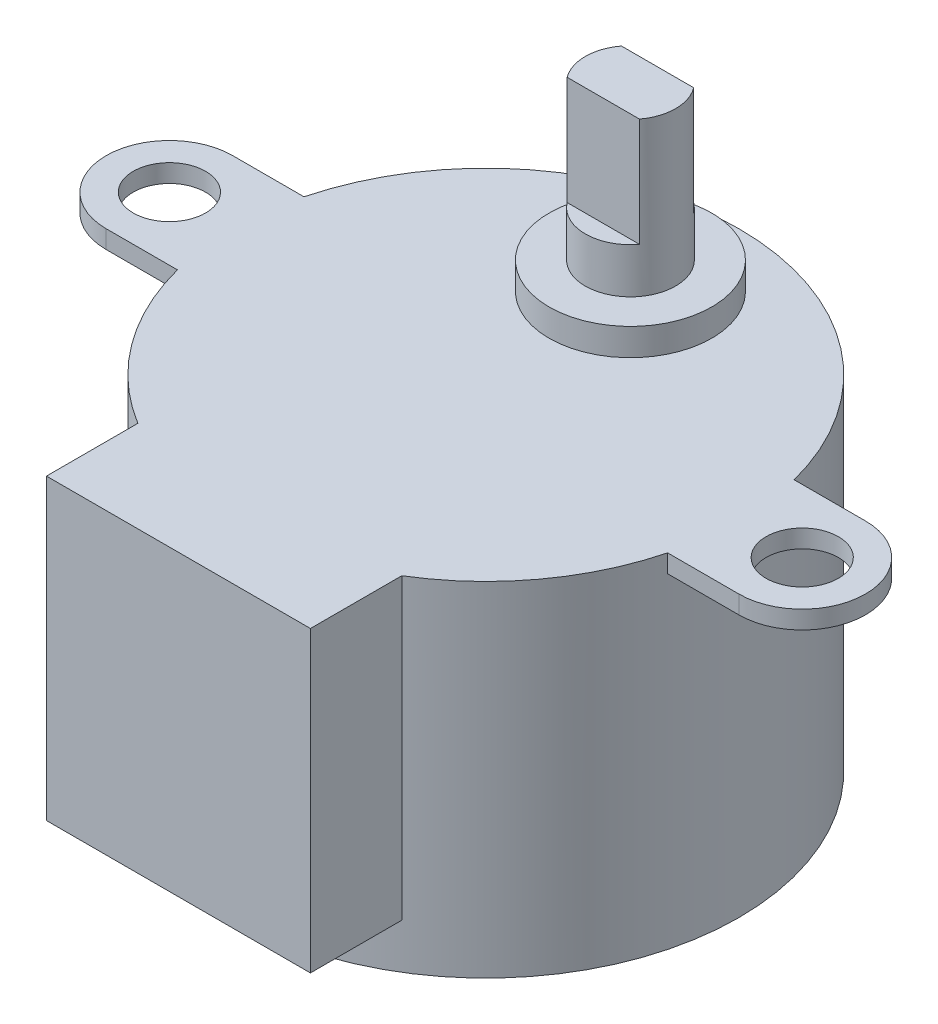
from build123d import *

# Parameters (mm, degrees)
SKETCH_1_R          = 14
EXTRUDE_1_DEPTH     = 19
SKETCH_2_R          = 4.5
EXTRUDE_2_DEPTH     = 1.5
SKETCH_3_R          = 2.5
EXTRUDE_3_DEPTH     = 8.5
CUT_EXTRUDE_START   = -6
CUT_EXTRUDE_1_DEPTH = 6
EXTRUDE_START       = -1
SKETCH_5_R          = 2
EXTRUDE_4_DEPTH     = 1
EXTRUDE_START_2     = -16.5
EXTRUDE_5_DEPTH     = 16.5


with BuildPart() as part:
    # Эскиз1 → Бобышка-Вытянуть1 (new body)
    with BuildSketch(Plane(origin=(0, 0, 0), x_dir=(1, 0, 0), z_dir=(0, 1, 0))):
        with Locations(Location((0, 0, 0), (0, 0, 270))):
            Circle(SKETCH_1_R)
    extrude(amount=EXTRUDE_1_DEPTH)

    # Эскиз2 → Бобышка-Вытянуть2 (add)
    with BuildSketch(Plane(origin=(0, 19, 0), x_dir=(1, 0, 0), z_dir=(0, 1, 0))):
        with Locations(Location((0, 8, 0), (0, 0, 270))):
            Circle(SKETCH_2_R)
    extrude(amount=EXTRUDE_2_DEPTH)

    # Эскиз3 → Бобышка-Вытянуть3 (add)
    with BuildSketch(Plane(origin=(0, 20.5, 0), x_dir=(1, 0, 0), z_dir=(0, 1, 0))):
        with Locations(Location((0, 8, 0), (0, 0, 270))):
            Circle(SKETCH_3_R)
    extrude(amount=EXTRUDE_3_DEPTH)

    # Эскиз4 → Вырез-Вытянуть1 (cut)
    with BuildSketch(Plane(origin=(0, 29, 0), x_dir=(1, 0, 0), z_dir=(0, 1, 0)).offset(CUT_EXTRUDE_START)):
        with BuildLine():
            Line((-2, 9.5), (2, 9.5))
            ThreePointArc((2, 9.5), (0, 10.5), (-2, 9.5))
        make_face()
        with BuildLine():
            Line((-2, 6.5), (2, 6.5))
            ThreePointArc((2, 6.5), (0, 5.5), (-2, 6.5))
        make_face()
    extrude(amount=CUT_EXTRUDE_1_DEPTH, mode=Mode.SUBTRACT)

    # Эскиз5 → Бобышка-Вытянуть4 (add)
    # profile 1 of 2: a face of its own
    with BuildSketch(Plane(origin=(0, 19, 0), x_dir=(1, 0, 0), z_dir=(0, 1, 0)).offset(EXTRUDE_START)):
        with BuildLine():
            Line((-17.5, 3.5), (-13.555441712, 3.5))
            ThreePointArc((-13.555441712, 3.5), (-14, 0), (-13.555441712, -3.5))
            Line((-13.555441712, -3.5), (-17.5, -3.5))
            ThreePointArc((-17.5, -3.5), (-21, 0), (-17.5, 3.5))
        make_face()
        with Locations(Location((-17.5, 0, 0), (0, 0, 270))):
            Circle(SKETCH_5_R, mode=Mode.SUBTRACT)
    # profile 2 of 2: a face of its own
    with BuildSketch(Plane(origin=(0, 19, 0), x_dir=(1, 0, 0), z_dir=(0, 1, 0)).offset(EXTRUDE_START)):
        with BuildLine():
            Line((17.5, 3.5), (13.555441712, 3.5))
            ThreePointArc((13.555441712, 3.5), (14, 0), (13.555441712, -3.5))
            Line((13.555441712, -3.5), (17.5, -3.5))
            ThreePointArc((17.5, -3.5), (21, 0), (17.5, 3.5))
        make_face()
        with Locations(Location((17.5, 0, 0), (0, 0, 90))):
            Circle(SKETCH_5_R, mode=Mode.SUBTRACT)
    extrude(amount=EXTRUDE_4_DEPTH)

    # Эскиз6 → Бобышка-Вытянуть5 (add)
    with BuildSketch(Plane(origin=(0, 19, 0), x_dir=(1, 0, 0), z_dir=(0, 1, 0)).offset(EXTRUDE_START_2)):
        with BuildLine():
            Line((7.3, -17), (-7.3, -17))
            Line((-7.3, -17), (-7.3, -11.94612908))
            ThreePointArc((-7.3, -11.94612908), (0, -14), (7.3, -11.94612908))
            Line((7.3, -11.94612908), (7.3, -17))
        make_face()
    extrude(amount=EXTRUDE_5_DEPTH)


solid = part.part
